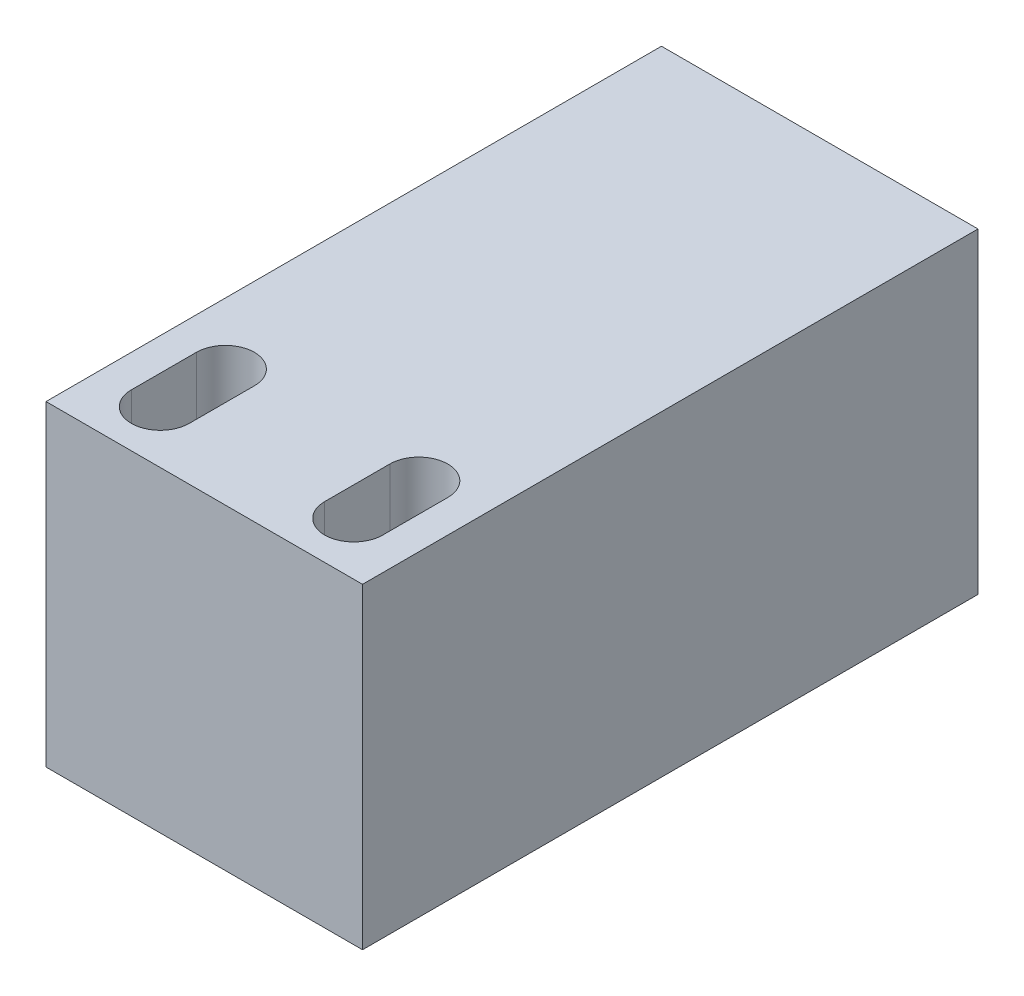
from build123d import *

# Parameters (mm, degrees)
SKETCH_1_W          = 18
SKETCH_1_H          = 18
EXTRUDE_1_DEPTH     = 35
CUT_EXTRUDE_2_DEPTH = 35


with BuildPart() as part:
    # 草图1 → 拉伸1 (new body)
    with BuildSketch(Plane.XY):
        Rectangle(SKETCH_1_W, SKETCH_1_H)
    extrude(amount=EXTRUDE_1_DEPTH)

    # 草图2 → 拉伸2 (cut)
    with BuildSketch(Plane(origin=(0, 9, 0), x_dir=(1, 0, 0), z_dir=(0, 1, 0))):
        with BuildLine():
            Line((3.85, -32), (3.85, -28.3))
            ThreePointArc((3.85, -28.3), (5.5, -26.65), (7.15, -28.3))
            Line((7.15, -28.3), (7.15, -32))
            ThreePointArc((7.15, -32), (5.5, -33.65), (3.85, -32))
        make_face()
        with BuildLine():
            Line((-7.15, -32), (-7.15, -28.3))
            ThreePointArc((-7.15, -28.3), (-5.5, -26.65), (-3.85, -28.3))
            Line((-3.85, -28.3), (-3.85, -32))
            ThreePointArc((-3.85, -32), (-5.5, -33.65), (-7.15, -32))
        make_face()
    extrude(amount=-CUT_EXTRUDE_2_DEPTH, mode=Mode.SUBTRACT)


solid = part.part
